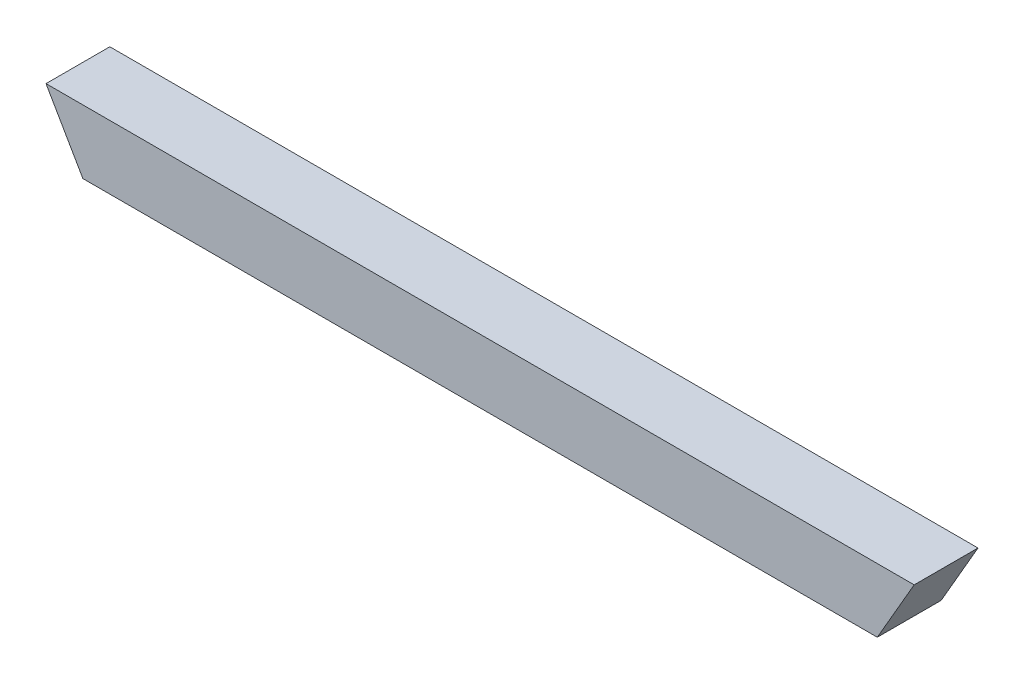
from build123d import *

# Parameters (mm, degrees)
BOSS_EXTRUDE1_DEPTH = 20


with BuildPart() as part:
    # Sketch1 → Boss-Extrude1 (new body)
    with BuildSketch(Plane.XY):
        Polygon((-67.666666667, 34.833333333), (204.403333333, 34.833333333), (192.848333333, 14.833333333), (-56.111666667, 14.833333333), align=None)
    extrude(amount=BOSS_EXTRUDE1_DEPTH)


solid = part.part
